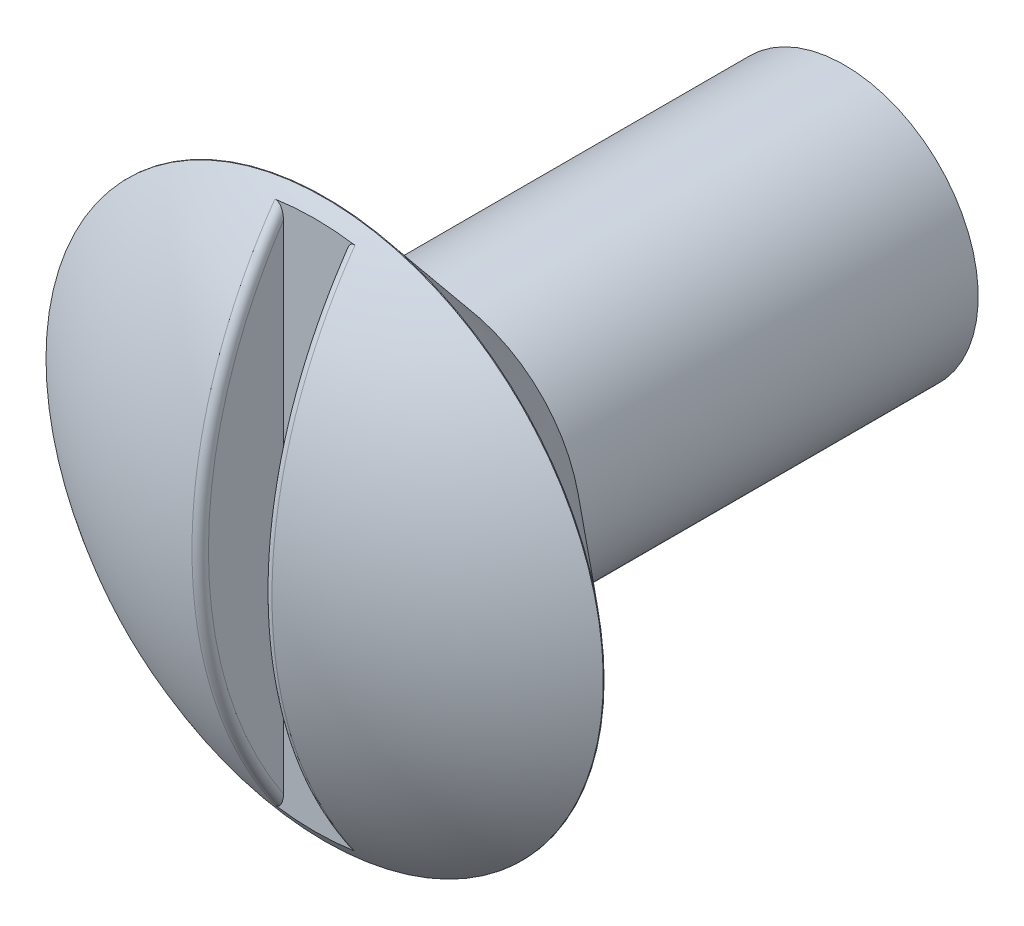
from build123d import *

# Parameters (mm, degrees)
SKETCH1_R           = 3.5433
BOSS_EXTRUDE1_DEPTH = 0.01
DOME1_FACE_RADIUS   = 3.5433
DOME1_HEIGHT        = 1.2
SKETCH2_R           = 3.5433
BOSS_EXTRUDE2_DEPTH = 1.5
BOSS_EXTRUDE2_TAPER = 50
SKETCH3_R           = 1.7
BOSS_EXTRUDE3_DEPTH = 5.1
SKETCH4_W           = 0.8
SKETCH4_H           = 7.6
CUT_EXTRUDE1_DEPTH  = 3
FILLET3_R           = 0.1


with BuildPart() as part:
    # Sketch1 → Boss-Extrude1 (new body)
    with BuildSketch(Plane.XY):
        with Locations(Location((0, 0, 0), (0, 0, 180))):
            Circle(SKETCH1_R)
    extrude(amount=BOSS_EXTRUDE1_DEPTH)

    # Dome1: a dome of height H over a round flat face of radius A is a cap of a sphere of radius (A * A + H * H) / (2 * H)
    dome1_r = (DOME1_FACE_RADIUS * DOME1_FACE_RADIUS + DOME1_HEIGHT * DOME1_HEIGHT) / (2 * DOME1_HEIGHT)
    dome1_base = Plane((0, 0, 0.01), z_dir=(0, 0, 1))
    with Locations(dome1_base.offset(DOME1_HEIGHT - dome1_r)):
        dome1_ball = Sphere(dome1_r, mode=Mode.PRIVATE)
    add(split(dome1_ball, bisect_by=dome1_base, keep=Keep.TOP, mode=Mode.PRIVATE))

    # Sketch2 → Boss-Extrude2 (add)
    with BuildSketch(Plane(origin=(0, 0, 0), x_dir=(-1, 0, 0), z_dir=(0, 0, -1))):
        Circle(SKETCH2_R)
    extrude(amount=BOSS_EXTRUDE2_DEPTH, taper=BOSS_EXTRUDE2_TAPER)

    # Sketch3 → Boss-Extrude3 (add)
    with BuildSketch(Plane(origin=(0, 0, -1.5), x_dir=(-1, 0, 0), z_dir=(0, 0, -1))):
        Circle(SKETCH3_R)
    extrude(amount=BOSS_EXTRUDE3_DEPTH)

    # Sketch4 → Cut-Extrude1 (cut)
    with BuildSketch(Plane.XY.offset(0.133904)):
        Rectangle(SKETCH4_W, SKETCH4_H)
    extrude(amount=CUT_EXTRUDE1_DEPTH, mode=Mode.SUBTRACT)

    # Fillet3
    fillet3_edges = [part.edges().sort_by_distance(p)[0] for p in [
        (0.4, -1.757880439, 0.924318226),
        (-0.4, 0, 1.196264613),
    ]]
    fillet(fillet3_edges, radius=FILLET3_R)


solid = part.part
